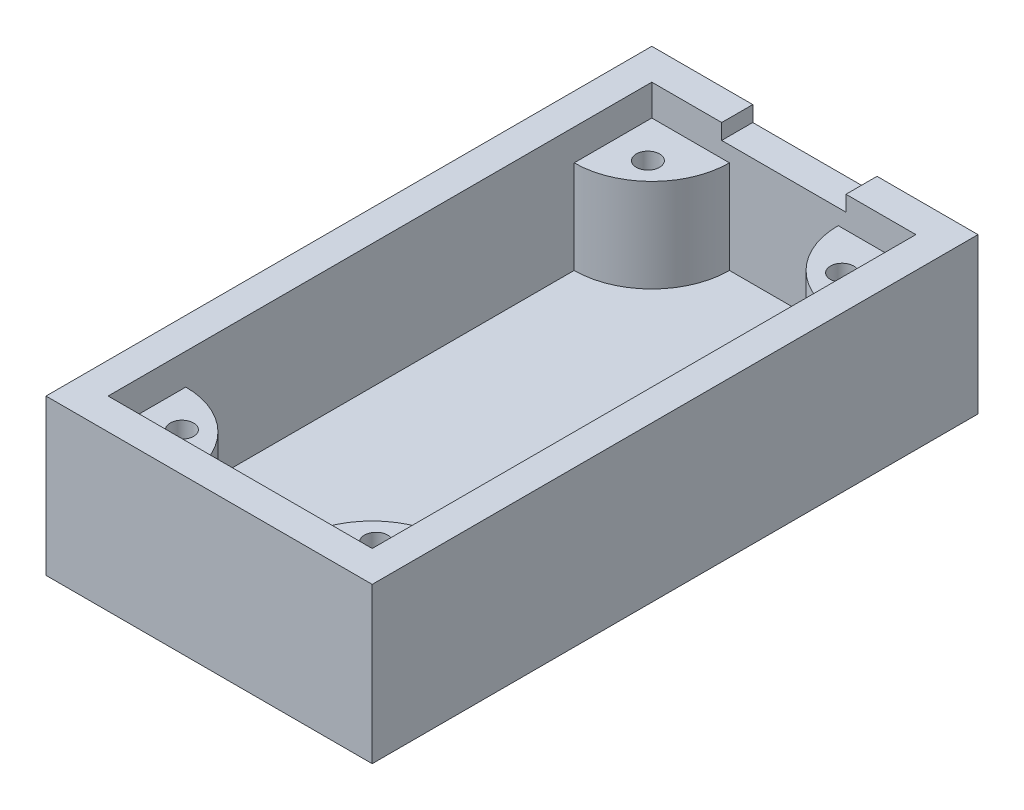
from build123d import *

# Parameters (mm, degrees)
SKETCH1_W           = 21
SKETCH1_H           = 39
SKETCH1_W_2         = 17
SKETCH1_H_2         = 35
BOSS_EXTRUDE1_DEPTH = 8
SKETCH2_W           = 21
SKETCH2_H           = 39
BOSS_EXTRUDE2_DEPTH = 2
SKETCH3_R           = 0.75
BOSS_EXTRUDE3_DEPTH = 6
CUT_EXTRUDE1_REACH  = 46.113
SKETCH4_W           = 8
SKETCH4_H           = 1


with BuildPart() as part:
    # Sketch1 → Boss-Extrude1 (new body)
    with BuildSketch(Plane(origin=(0, 0, 0), x_dir=(1, 0, 0), z_dir=(0, 1, 0))):
        with Locations((8.5, 17.5)):
            Rectangle(SKETCH1_W, SKETCH1_H)
        with Locations((8.5, 17.5)):
            Rectangle(SKETCH1_W_2, SKETCH1_H_2, mode=Mode.SUBTRACT)
    extrude(amount=BOSS_EXTRUDE1_DEPTH)

    # Sketch2 → Boss-Extrude2 (add)
    with BuildSketch(Plane.XZ):
        with Locations((8.5, -17.5)):
            Rectangle(SKETCH2_W, SKETCH2_H)
    extrude(amount=BOSS_EXTRUDE2_DEPTH)

    # Sketch3 → Boss-Extrude3 (add)
    # profile 1 of 4: a face of its own
    with BuildSketch(Plane(origin=(0, 0, 0), x_dir=(1, 0, 0), z_dir=(0, 1, 0))):
        with BuildLine():
            Line((0, 30), (0, 35))
            Line((0, 35), (5, 35))
            ThreePointArc((5, 35), (3.535533906, 31.464466094), (0, 30))
        make_face()
        with Locations(Location((2.25, 32.5, 0), (0, 0, 270))):
            Circle(SKETCH3_R, mode=Mode.SUBTRACT)
    # profile 2 of 4: a face of its own
    with BuildSketch(Plane(origin=(0, 0, 0), x_dir=(1, 0, 0), z_dir=(0, 1, 0))):
        with BuildLine():
            Line((17, 0), (12, 0))
            ThreePointArc((12, 0), (13.464466094, 3.535533906), (17, 5))
            Line((17, 5), (17, 0))
        make_face()
        with Locations(Location((14.75, 2.5, 0), (0, 0, 270))):
            Circle(SKETCH3_R, mode=Mode.SUBTRACT)
    # profile 3 of 4: a face of its own
    with BuildSketch(Plane(origin=(0, 0, 0), x_dir=(1, 0, 0), z_dir=(0, 1, 0))):
        with BuildLine():
            Line((17, 35), (12, 35))
            ThreePointArc((12, 35), (13.464466094, 31.464466094), (17, 30))
            Line((17, 30), (17, 35))
        make_face()
        with Locations(Location((14.75, 32.5, 0), (0, 0, 270))):
            Circle(SKETCH3_R, mode=Mode.SUBTRACT)
    # profile 4 of 4: a face of its own
    with BuildSketch(Plane(origin=(0, 0, 0), x_dir=(1, 0, 0), z_dir=(0, 1, 0))):
        with BuildLine():
            Line((0, 0), (0, 5))
            ThreePointArc((0, 5), (3.535533906, 3.535533906), (5, 0))
            Line((5, 0), (0, 0))
        make_face()
        with Locations(Location((2.25, 2.5, 0), (0, 0, 270))):
            Circle(SKETCH3_R, mode=Mode.SUBTRACT)
    extrude(amount=BOSS_EXTRUDE3_DEPTH)

    # Sketch4 → Cut-Extrude1 (cut, up to next)
    with BuildSketch(Plane(origin=(0, 0, -37), x_dir=(-1, 0, 0), z_dir=(0, 0, -1)), mode=Mode.PRIVATE) as cut_extrude1_sk1:
        with Locations((-8.5, 7.5)):
            Rectangle(SKETCH4_W, SKETCH4_H)
    cut_extrude1_tool1 = extrude(cut_extrude1_sk1.sketch, amount=-CUT_EXTRUDE1_REACH, mode=Mode.PRIVATE) & part.part
    add(cut_extrude1_tool1.solids().sort_by_distance((8.5, 7.5, -37))[0], mode=Mode.SUBTRACT)


solid = part.part
